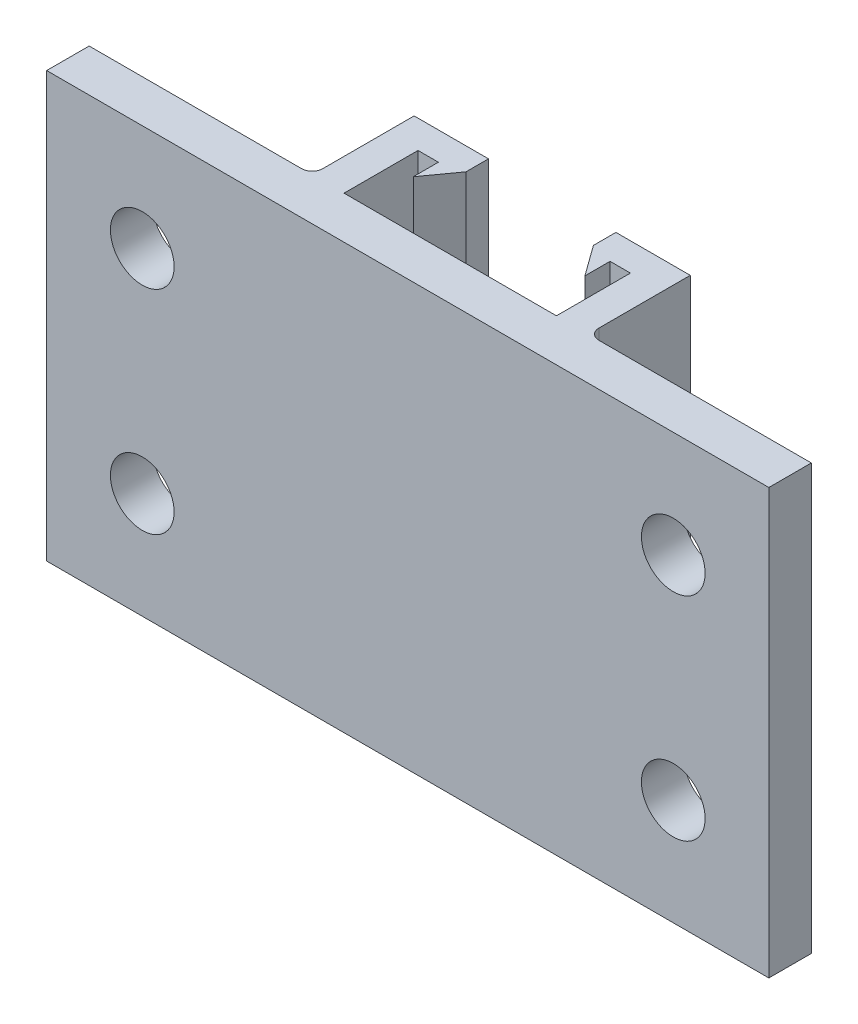
from build123d import *

# Parameters (mm, degrees)
CROQUIS1_W              = 34
CROQUIS1_H              = 20
CROQUIS1_R              = 1.5
BASE_DEPTH              = 2
SALIENTE_EXTRUIR2_DEPTH = 20
REDONDEO1_R             = 0.5


with BuildPart() as part:
    # Croquis1 → Base (new body)
    with BuildSketch(Plane.XY):
        Rectangle(CROQUIS1_W, CROQUIS1_H)
        with Locations((12.5, 5)):
            Circle(CROQUIS1_R, mode=Mode.SUBTRACT)
        with Locations((-12.5, 5)):
            Circle(CROQUIS1_R, mode=Mode.SUBTRACT)
        with Locations((-12.5, -5)):
            Circle(CROQUIS1_R, mode=Mode.SUBTRACT)
        with Locations((12.5, -5)):
            Circle(CROQUIS1_R, mode=Mode.SUBTRACT)
    extrude(amount=BASE_DEPTH)

    # Croquis2 → Saliente-Extruir2 (add, through all)
    with BuildSketch(Plane(origin=(0, 10, 0), x_dir=(1, 0, 0), z_dir=(0, 1, 0))):
        Polygon((-5, 0), (-6.5, 0), (-6.5, 4.8), (-3, 4.8), (-3, 3.741089378), (-4.040563392, 2.3), (-4.040563392, 3.482732018), (-5, 3.482732018), align=None)
        Polygon((3, 4.8), (6.5, 4.8), (6.5, 0), (5, 0), (5, 3.482732018), (4.040563392, 3.482732018), (4.040563392, 2.3), (3, 3.741089378), align=None)
    extrude(amount=-SALIENTE_EXTRUIR2_DEPTH)

    # Redondeo1
    redondeo1_edges = [part.edges().sort_by_distance(p)[0] for p in [
        (-6.5, 0, 0),
        (6.5, 0, 0),
    ]]
    fillet(redondeo1_edges, radius=REDONDEO1_R)


solid = part.part
